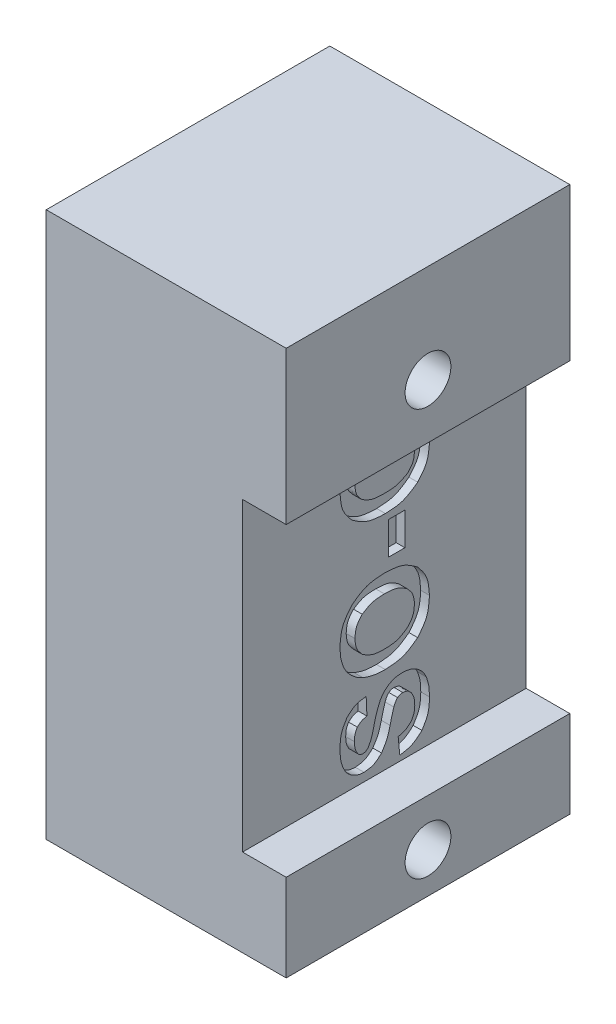
from build123d import *

# Parameters (mm, degrees)
ESQUISSE1_W                         = 25
ESQUISSE1_H                         = 13
BOSS_EXTRU_1_DEPTH                  = 11
ESQUISSE2_W                         = 2
ESQUISSE2_H                         = 14
ENL_V_MAT_EXTRU_1_DEPTH             = 36.605336679
ENL_V_START                         = 1.2
ENL_V_MAT_EXTRU_2_DEPTH             = 0.4
BOSS_EXTRU_2_START                  = 1.2
BOSS_EXTRU_2_DEPTH                  = 0.4
ENL_V_MAT_EXTRU_3_DEPTH             = 0.4
ENL_V_MAT_EXTRU_4_DEPTH             = 0.4
ESQUISSE7_W                         = 0.760486722
ESQUISSE7_H                         = 1.493910551
ENL_V_MAT_EXTRU_5_DEPTH             = 0.4
DIAM_TRE_DU_PER_AGE_2_1_2_1_1_D     = 2.1
DIAM_TRE_DU_PER_AGE_2_1_2_1_1_DEPTH = 8
DIAM_TRE_DU_PER_AGE_2_1_2_1_2_D     = 2.1
DIAM_TRE_DU_PER_AGE_2_1_2_1_2_DEPTH = 8
DIAM_TRE_DU_PER_AGE_2_1_2_1_3_D     = 2.1
DIAM_TRE_DU_PER_AGE_2_1_2_1_3_DEPTH = 10


with BuildPart() as part:
    # Esquisse1 → Boss.-Extru.1 (new body)
    with BuildSketch(Plane(origin=(-30.7, 0, 0), x_dir=(0, -1, 0), z_dir=(-1, 0, 0))):
        Rectangle(ESQUISSE1_W, ESQUISSE1_H)
    extrude(amount=-BOSS_EXTRU_1_DEPTH)

    # Esquisse2 → Enlèv. mat.-Extru.1 (cut, through all)
    with BuildSketch(Plane.XY.offset(6.5)):
        with Locations((-20.7, -1.5)):
            Rectangle(ESQUISSE2_W, ESQUISSE2_H)
    extrude(amount=-ENL_V_MAT_EXTRU_1_DEPTH, mode=Mode.SUBTRACT)

    # Esquisse3 → Enlèv. mat.-Extru.2 (cut)
    with BuildSketch(Plane(origin=(-22.9, 0, 0), x_dir=(0, 0, -1), z_dir=(1, 0, 0)).offset(ENL_V_START)):
        with BuildLine():
            add(Edge.make_bspline(
                [(0.040594995, -4.523004446), (-0.046422495, -4.520684567), (-0.219772179, -4.516063079), (-0.478972443, -4.491355823), (-0.731337882, -4.427247103), (-0.894894011, -4.370276318), (-0.976995766, -4.341678176)],
                knots=[0, 0, 0, 0, 0.251162513, 0.500347025, 0.749184658, 1, 1, 1, 1], degree=3))
            add(Edge.make_bspline(
                [(-0.976995766, -4.341678176), (-1.026357361, -4.316975059), (-1.124792503, -4.267712979), (-1.267429981, -4.184138388), (-1.397682287, -4.082332373), (-1.479796659, -4.009022434), (-1.52097398, -3.972260211)],
                knots=[0, 0, 0, 0, 0.250726491, 0.499989878, 0.749263416, 1, 1, 1, 1], degree=3))
            add(Edge.make_bspline(
                [(-1.52097398, -3.972260211), (-1.557178279, -3.934098826), (-1.629307823, -3.858070192), (-1.729119676, -3.736334691), (-1.809138662, -3.600764554), (-1.855129407, -3.50664624), (-1.878213823, -3.45940486)],
                knots=[0, 0, 0, 0, 0.251028015, 0.500121179, 0.749092765, 1, 1, 1, 1], degree=3))
            add(Edge.make_bspline(
                [(-1.878213823, -3.45940486), (-1.902220115, -3.390341102), (-1.950052601, -3.25273171), (-2.005132825, -3.040816696), (-2.027729246, -2.823032417), (-2.032691965, -2.67732347), (-2.035182655, -2.604195032)],
                knots=[0, 0, 0, 0, 0.250838507, 0.499795194, 0.748957105, 1, 1, 1, 1], degree=3))
            add(Edge.make_bspline(
                [(-2.035182655, -2.604195032), (-2.026340136, -2.473815013), (-2.008930644, -2.217117807), (-1.929735902, -1.837119439), (-1.735359102, -1.501123085), (-1.573448479, -1.30206219), (-1.491204441, -1.200947318)],
                knots=[0, 0, 0, 0, 0.254339308, 0.500753032, 0.746402764, 1, 1, 1, 1], degree=3))
            add(Edge.make_bspline(
                [(-1.491204441, -1.200947318), (-1.380071608, -1.118987874), (-1.160946279, -0.957384955), (-0.795128636, -0.768288084), (-0.389803116, -0.695631023), (-0.116794444, -0.681650484), (0.021650851, -0.674560819)],
                knots=[0, 0, 0, 0, 0.253014305, 0.498879059, 0.745876803, 1, 1, 1, 1], degree=3))
            add(Edge.make_bspline(
                [(0.021650851, -0.674560819), (0.159167503, -0.681650554), (0.430369175, -0.695632483), (0.833008724, -0.767873806), (1.196561887, -0.95543316), (1.414508778, -1.115642867), (1.525033772, -1.196888242)],
                knots=[0, 0, 0, 0, 0.254088734, 0.501097783, 0.746997243, 1, 1, 1, 1], degree=3))
            add(Edge.make_bspline(
                [(1.525033772, -1.196888242), (1.607118875, -1.297413695), (1.768699501, -1.495293274), (1.962661916, -1.829598882), (2.04157244, -2.207949878), (2.058871581, -2.463538996), (2.067658961, -2.593369637)],
                knots=[0, 0, 0, 0, 0.253616174, 0.499231391, 0.745626458, 1, 1, 1, 1], degree=3))
            add(Edge.make_bspline(
                [(2.067658961, -2.593369637), (2.059143735, -2.723983704), (2.042378031, -2.981150912), (1.964487284, -3.362002257), (1.771283211, -3.699334424), (1.609776883, -3.899170914), (1.527740419, -4.000677023)],
                knots=[0, 0, 0, 0, 0.254372897, 0.500837075, 0.74645228, 1, 1, 1, 1], degree=3))
            add(Edge.make_bspline(
                [(1.527740419, -4.000677023), (1.418586795, -4.081646603), (1.203372143, -4.241291691), (0.844072853, -4.428732714), (0.445406966, -4.501428012), (0.176809234, -4.515744242), (0.040594995, -4.523004446)],
                knots=[0, 0, 0, 0, 0.25305653, 0.498943336, 0.74589863, 1, 1, 1, 1], degree=3))
        make_face()
    extrude(amount=-ENL_V_MAT_EXTRU_2_DEPTH, mode=Mode.SUBTRACT)

    # Esquisse4 → Boss.-Extru.2 (add)
    with BuildSketch(Plane(origin=(-20.9, 0, 0), x_dir=(0, -1, 0), z_dir=(-1, 0, 0)).offset(BOSS_EXTRU_2_START)):
        with BuildLine():
            add(Edge.make_bspline(
                [(3.394452486, 1.010825574), (3.443912481, 0.933792398), (3.541639282, 0.781584417), (3.651183184, 0.531021304), (3.689489976, 0.260274993), (3.694851512, 0.078471065), (3.697564755, -0.013532102)],
                knots=[0, 0, 0, 0, 0.252270406, 0.49845496, 0.746189574, 1, 1, 1, 1], degree=3))
            add(Edge.make_bspline(
                [(3.697564755, -0.013532102), (3.694414508, -0.105526456), (3.688190776, -0.287273553), (3.647935026, -0.557798315), (3.535654055, -0.8072106), (3.436517625, -0.958564642), (3.386333141, -1.035182536)],
                knots=[0, 0, 0, 0, 0.253802578, 0.501420795, 0.747611043, 1, 1, 1, 1], degree=3))
            add(Edge.make_bspline(
                [(3.386333141, -1.035182536), (3.330815111, -1.085902627), (3.221714119, -1.185574971), (3.035164564, -1.308720354), (2.818246912, -1.362683644), (2.67100264, -1.376115239), (2.596076284, -1.382950008)],
                knots=[0, 0, 0, 0, 0.254357119, 0.499848676, 0.745494232, 1, 1, 1, 1], degree=3))
            add(Edge.make_bspline(
                [(2.596076284, -1.382950008), (2.521526964, -1.376269982), (2.375039389, -1.363143896), (2.15917707, -1.309881978), (1.973527771, -1.187538184), (1.865073728, -1.088362432), (1.809878502, -1.037889183)],
                knots=[0, 0, 0, 0, 0.25456394, 0.500211864, 0.745644162, 1, 1, 1, 1], degree=3))
            add(Edge.make_bspline(
                [(1.809878502, -1.037889183), (1.759857117, -0.960041305), (1.661019721, -0.806221464), (1.55005107, -0.553066862), (1.511074144, -0.279440547), (1.505518165, -0.095692068), (1.502706561, -0.00270611)],
                knots=[0, 0, 0, 0, 0.252280735, 0.498482217, 0.746206815, 1, 1, 1, 1], degree=3))
            add(Edge.make_bspline(
                [(1.502706561, -0.00270611), (1.505309223, 0.08863176), (1.510452564, 0.269132281), (1.54805992, 0.537966508), (1.656170468, 0.78698293), (1.752838656, 0.938305219), (1.801759753, 1.014885247)],
                knots=[0, 0, 0, 0, 0.253806378, 0.50156833, 0.747757507, 1, 1, 1, 1], degree=3))
            add(Edge.make_bspline(
                [(1.801759753, 1.014885247), (1.857757724, 1.064861164), (1.967795985, 1.163065849), (2.156234072, 1.282789354), (2.373779463, 1.332946883), (2.521107505, 1.344562847), (2.596076284, 1.350473702)],
                knots=[0, 0, 0, 0, 0.254161073, 0.499436709, 0.745285299, 1, 1, 1, 1], degree=3))
            add(Edge.make_bspline(
                [(2.596076284, 1.350473702), (2.671482303, 1.344366756), (2.819670952, 1.332365326), (3.038404084, 1.281254226), (3.227646687, 1.160239733), (3.338195676, 1.061216891), (3.394452486, 1.010825574)],
                knots=[0, 0, 0, 0, 0.254674744, 0.500489308, 0.745806107, 1, 1, 1, 1], degree=3))
        make_face()
    extrude(amount=-BOSS_EXTRU_2_DEPTH)

    # Esquisse5 → Enlèv. mat.-Extru.3 (cut)
    with BuildSketch(Plane(origin=(-22.9, 0, 0), x_dir=(0, 0, -1), z_dir=(1, 0, 0)).offset(ENL_V_START)):
        with BuildLine():
            Line((0.709066451, -8.263193894), (0.633288085, -7.483762208))
            add(Edge.make_bspline(
                [(0.633288085, -7.483762208), (0.687256765, -7.472084507), (0.794028455, -7.448981332), (0.949885206, -7.39706427), (1.087277118, -7.306991475), (1.168623101, -7.234755917), (1.209743083, -7.198241208)],
                knots=[0, 0, 0, 0, 0.253315392, 0.501159424, 0.747838616, 1, 1, 1, 1], degree=3))
            add(Edge.make_bspline(
                [(1.209743083, -7.198241208), (1.238457302, -7.154637761), (1.295204574, -7.068465241), (1.361071924, -6.92722817), (1.386435876, -6.773471154), (1.39130952, -6.670052932), (1.393775403, -6.617727134)],
                knots=[0, 0, 0, 0, 0.252518221, 0.499046139, 0.746535866, 1, 1, 1, 1], degree=3))
            add(Edge.make_bspline(
                [(1.393775403, -6.617727134), (1.39232195, -6.565717407), (1.389446587, -6.462826655), (1.36877357, -6.309509672), (1.309717622, -6.166508798), (1.256794187, -6.078829955), (1.230040252, -6.034506414)],
                knots=[0, 0, 0, 0, 0.253454508, 0.501408609, 0.747951331, 1, 1, 1, 1], degree=3))
            add(Edge.make_bspline(
                [(1.230040252, -6.034506414), (1.20390277, -6.007361843), (1.152605236, -5.954087791), (1.064043427, -5.885996615), (0.957416608, -5.852670934), (0.884333544, -5.843148162), (0.847090542, -5.838295374)],
                knots=[0, 0, 0, 0, 0.255257105, 0.500968698, 0.745694518, 1, 1, 1, 1], degree=3))
            add(Edge.make_bspline(
                [(0.847090542, -5.838295374), (0.825381456, -5.839787761), (0.782471301, -5.842737611), (0.718851335, -5.855139298), (0.660953948, -5.884281969), (0.62550997, -5.908557581), (0.607577622, -5.920839462)],
                knots=[0, 0, 0, 0, 0.253127404, 0.50033132, 0.747200143, 1, 1, 1, 1], degree=3))
            add(Edge.make_bspline(
                [(0.607577622, -5.920839462), (0.588460605, -5.941773322), (0.550457616, -5.983388037), (0.501028126, -6.052392781), (0.465324019, -6.129394251), (0.445630421, -6.182401707), (0.435723722, -6.209066663)],
                knots=[0, 0, 0, 0, 0.251043979, 0.499053863, 0.748003242, 1, 1, 1, 1], degree=3))
            ThreePointArc((0.435723722, -6.209066663), (0.343828327, -6.528341304), (0.262516797, -6.850474034))
            add(Edge.make_bspline(
                [(0.262516797, -6.850474034), (0.241976515, -6.93115612), (0.201092051, -7.091750022), (0.123485013, -7.3279421), (0.008442026, -7.548357323), (-0.083643242, -7.685500076), (-0.129905283, -7.754398216)],
                knots=[0, 0, 0, 0, 0.25164559, 0.50088872, 0.749255151, 1, 1, 1, 1], degree=3))
            add(Edge.make_bspline(
                [(-0.129905283, -7.754398216), (-0.185795656, -7.806654055), (-0.295635847, -7.909351373), (-0.483202072, -8.037727861), (-0.702793417, -8.096393119), (-0.85223705, -8.11187755), (-0.928281486, -8.119756807)],
                knots=[0, 0, 0, 0, 0.254537648, 0.500237559, 0.745695736, 1, 1, 1, 1], degree=3))
            add(Edge.make_bspline(
                [(-0.928281486, -8.119756807), (-0.978512466, -8.116034508), (-1.078171026, -8.108649445), (-1.226105087, -8.081251242), (-1.364255079, -8.021673352), (-1.451360542, -7.972624809), (-1.495264113, -7.947902981)],
                knots=[0, 0, 0, 0, 0.251968132, 0.499906252, 0.747938868, 1, 1, 1, 1], degree=3))
            add(Edge.make_bspline(
                [(-1.495264113, -7.947902981), (-1.538042945, -7.914536074), (-1.622887543, -7.84835844), (-1.738409967, -7.734679897), (-1.825181626, -7.597792301), (-1.873032093, -7.501293315), (-1.897157967, -7.452639196)],
                knots=[0, 0, 0, 0, 0.251958418, 0.499717032, 0.7477608, 1, 1, 1, 1], degree=3))
            add(Edge.make_bspline(
                [(-1.897157967, -7.452639196), (-1.918714534, -7.389554812), (-1.961665947, -7.263859314), (-2.010344633, -7.07021971), (-2.029490521, -6.871478992), (-2.033280526, -6.738562347), (-2.035182655, -6.671854112)],
                knots=[0, 0, 0, 0, 0.250795609, 0.499709706, 0.748914199, 1, 1, 1, 1], degree=3))
            add(Edge.make_bspline(
                [(-2.035182655, -6.671854112), (-2.032174727, -6.571119326), (-2.026228196, -6.371971403), (-1.984640816, -6.075351621), (-1.866442291, -5.800116506), (-1.761035373, -5.632270265), (-1.707712948, -5.547361527)],
                knots=[0, 0, 0, 0, 0.25365234, 0.501458717, 0.747801849, 1, 1, 1, 1], degree=3))
            add(Edge.make_bspline(
                [(-1.707712948, -5.547361527), (-1.646474429, -5.490800728), (-1.526027277, -5.379553966), (-1.319583893, -5.242044736), (-1.079737579, -5.178797033), (-0.916531782, -5.160289094), (-0.833558977, -5.150879774)],
                knots=[0, 0, 0, 0, 0.253962076, 0.499506011, 0.745551991, 1, 1, 1, 1], degree=3))
            Line((-0.833558977, -5.150879774), (-0.798376143, -5.951962624))
            add(Edge.make_bspline(
                [(-0.798376143, -5.951962624), (-0.839940246, -5.960452836), (-0.922041667, -5.977223521), (-1.041844562, -6.016375643), (-1.146349606, -6.086847422), (-1.207300022, -6.143730605), (-1.238159478, -6.172530804)],
                knots=[0, 0, 0, 0, 0.253847823, 0.501424673, 0.747569185, 1, 1, 1, 1], degree=3))
            add(Edge.make_bspline(
                [(-1.238159478, -6.172530804), (-1.260257835, -6.211442959), (-1.304013687, -6.288490969), (-1.352316785, -6.413255909), (-1.368939308, -6.545998065), (-1.371055695, -6.635017617), (-1.372124493, -6.679973457)],
                knots=[0, 0, 0, 0, 0.25182155, 0.498619246, 0.746797278, 1, 1, 1, 1], degree=3))
            add(Edge.make_bspline(
                [(-1.372124493, -6.679973457), (-1.37058718, -6.728220695), (-1.367540153, -6.823848977), (-1.348753083, -6.966416031), (-1.297369106, -7.100729733), (-1.251719631, -7.184427942), (-1.228687108, -7.22665802)],
                knots=[0, 0, 0, 0, 0.252763647, 0.50098937, 0.748223311, 1, 1, 1, 1], degree=3))
            add(Edge.make_bspline(
                [(-1.228687108, -7.22665802), (-1.212421936, -7.24493005), (-1.180615671, -7.280660692), (-1.123878328, -7.325809398), (-1.054250125, -7.346043928), (-1.006717173, -7.351213382), (-0.98240906, -7.353857014)],
                knots=[0, 0, 0, 0, 0.255760638, 0.500135554, 0.744371831, 1, 1, 1, 1], degree=3))
            add(Edge.make_bspline(
                [(-0.98240906, -7.353857014), (-0.959110427, -7.351090783), (-0.913387043, -7.345662075), (-0.84647801, -7.325949393), (-0.790497868, -7.284337266), (-0.758066952, -7.251505262), (-0.741543114, -7.234777067)],
                knots=[0, 0, 0, 0, 0.254456033, 0.499367959, 0.744923565, 1, 1, 1, 1], degree=3))
            add(Edge.make_bspline(
                [(-0.741543114, -7.234777067), (-0.710086441, -7.177188167), (-0.647363389, -7.062358745), (-0.57177442, -6.880668102), (-0.519166251, -6.691060704), (-0.490631725, -6.562920729), (-0.476319134, -6.498647187)],
                knots=[0, 0, 0, 0, 0.250287699, 0.499061312, 0.748734897, 1, 1, 1, 1], degree=3))
            ThreePointArc((-0.476319134, -6.498647187), (-0.358855564, -6.057953043), (-0.190798581, -5.633964989))
            add(Edge.make_bspline(
                [(-0.190798581, -5.633964989), (-0.164703473, -5.590728045), (-0.112865755, -5.50483821), (-0.022753044, -5.38380573), (0.09013207, -5.283674019), (0.171492446, -5.225047458), (0.212449491, -5.19553468)],
                knots=[0, 0, 0, 0, 0.251752895, 0.500105059, 0.748351464, 1, 1, 1, 1], degree=3))
            add(Edge.make_bspline(
                [(0.212449491, -5.19553468), (0.26197014, -5.171062156), (0.360296503, -5.122470421), (0.515666779, -5.066415485), (0.679322958, -5.044115112), (0.789098772, -5.039524676), (0.844384491, -5.037212823)],
                knots=[0, 0, 0, 0, 0.251570815, 0.49950967, 0.747941124, 1, 1, 1, 1], degree=3))
            add(Edge.make_bspline(
                [(0.844384491, -5.037212823), (0.900834307, -5.041297249), (1.012864451, -5.049403189), (1.179233751, -5.079547605), (1.335035336, -5.145221586), (1.433480734, -5.199372421), (1.483085215, -5.226657841)],
                knots=[0, 0, 0, 0, 0.251899613, 0.499919254, 0.748020263, 1, 1, 1, 1], degree=3))
            add(Edge.make_bspline(
                [(1.483085215, -5.226657841), (1.530307333, -5.262374783), (1.623911725, -5.333173442), (1.751611407, -5.455434996), (1.84707773, -5.60423283), (1.89925354, -5.709441585), (1.925575197, -5.762517307)],
                knots=[0, 0, 0, 0, 0.252156898, 0.49982919, 0.747673786, 1, 1, 1, 1], degree=3))
            add(Edge.make_bspline(
                [(1.925575197, -5.762517307), (1.948537187, -5.832403504), (1.99429761, -5.971678106), (2.045510093, -6.1860006), (2.065050032, -6.405483885), (2.068589139, -6.552217409), (2.070365012, -6.625846181)],
                knots=[0, 0, 0, 0, 0.250726032, 0.499666168, 0.748939679, 1, 1, 1, 1], degree=3))
            add(Edge.make_bspline(
                [(2.070365012, -6.625846181), (2.066607158, -6.729613423), (2.05917894, -6.934732021), (2.013582011, -7.240056263), (1.888415518, -7.522272706), (1.77830609, -7.694384701), (1.722598135, -7.781461779)],
                knots=[0, 0, 0, 0, 0.25358793, 0.501271881, 0.74767716, 1, 1, 1, 1], degree=3))
            add(Edge.make_bspline(
                [(1.722598135, -7.781461779), (1.650863627, -7.846042867), (1.509281285, -7.973506511), (1.268645982, -8.131608754), (0.992958268, -8.214628756), (0.804528329, -8.24686331), (0.709066451, -8.263193894)],
                knots=[0, 0, 0, 0, 0.252841872, 0.499033807, 0.746201828, 1, 1, 1, 1], degree=3))
        make_face()
    extrude(amount=-ENL_V_MAT_EXTRU_3_DEPTH, mode=Mode.SUBTRACT)

    # Esquisse6 → Enlèv. mat.-Extru.4 (cut)
    with BuildSketch(Plane(origin=(-22.9, 0, 0), x_dir=(0, 0, -1), z_dir=(1, 0, 0)).offset(ENL_V_START)):
        with BuildLine():
            Line((0.541271627, 4.340324249), (0.787550867, 5.117049064))
            add(Edge.make_bspline(
                [(0.787550867, 5.117049064), (0.879839209, 5.087230443), (1.0625705, 5.028189453), (1.326291166, 4.910275935), (1.552643675, 4.730768654), (1.685344334, 4.592725336), (1.752368271, 4.523002949)],
                knots=[0, 0, 0, 0, 0.25292829, 0.500799037, 0.747865502, 1, 1, 1, 1], degree=3))
            add(Edge.make_bspline(
                [(1.752368271, 4.523002949), (1.800824268, 4.442528702), (1.896764757, 4.283193654), (2.008801153, 4.02600793), (2.053563685, 3.749080955), (2.062929066, 3.562903077), (2.067658961, 3.468875732)],
                knots=[0, 0, 0, 0, 0.252212145, 0.499367632, 0.747160441, 1, 1, 1, 1], degree=3))
            add(Edge.make_bspline(
                [(2.067658961, 3.468875732), (2.057599742, 3.34701706), (2.037808704, 3.107265886), (1.955641439, 2.753325328), (1.764047457, 2.444587832), (1.607375698, 2.262418851), (1.527740419, 2.169823494)],
                knots=[0, 0, 0, 0, 0.254308376, 0.500339704, 0.746025786, 1, 1, 1, 1], degree=3))
            add(Edge.make_bspline(
                [(1.527740419, 2.169823494), (1.418837283, 2.090931249), (1.204007088, 1.935302706), (0.846827959, 1.752875175), (0.452073486, 1.682060997), (0.186190746, 1.668103459), (0.051420987, 1.661028709)],
                knots=[0, 0, 0, 0, 0.252946512, 0.498980568, 0.746044936, 1, 1, 1, 1], degree=3))
            add(Edge.make_bspline(
                [(0.051420987, 1.661028709), (-0.088487763, 1.667476783), (-0.364598557, 1.680202096), (-0.774904456, 1.749639241), (-1.148227619, 1.933533868), (-1.373157818, 2.092148873), (-1.487144768, 2.172529545)],
                knots=[0, 0, 0, 0, 0.253957413, 0.501186545, 0.747218362, 1, 1, 1, 1], degree=3))
            add(Edge.make_bspline(
                [(-1.487144768, 2.172529545), (-1.568998305, 2.268440237), (-1.73000739, 2.457100296), (-1.925366173, 2.777493513), (-2.006897615, 3.143780771), (-2.025650037, 3.391610087), (-2.035182655, 3.517591801)],
                knots=[0, 0, 0, 0, 0.253896252, 0.49942379, 0.745536767, 1, 1, 1, 1], degree=3))
            add(Edge.make_bspline(
                [(-2.035182655, 3.517591801), (-2.028196441, 3.626141361), (-2.014417545, 3.840233465), (-1.951838326, 4.157549325), (-1.798497796, 4.442323677), (-1.670017956, 4.613482116), (-1.604871094, 4.700269546)],
                knots=[0, 0, 0, 0, 0.253854576, 0.500676923, 0.746813731, 1, 1, 1, 1], degree=3))
            add(Edge.make_bspline(
                [(-1.604871094, 4.700269546), (-1.551416996, 4.746663475), (-1.445229024, 4.838826233), (-1.270795118, 4.958841352), (-1.075790959, 5.041310919), (-0.941668519, 5.084489573), (-0.874153912, 5.106224861)],
                knots=[0, 0, 0, 0, 0.251401467, 0.499415622, 0.748015637, 1, 1, 1, 1], degree=3))
            Line((-0.874153912, 5.106224861), (-0.684708893, 4.313261356))
            add(Edge.make_bspline(
                [(-0.684708893, 4.313261356), (-0.731438218, 4.299359166), (-0.823881707, 4.271856801), (-0.957224971, 4.214182381), (-1.070981185, 4.123811678), (-1.137983855, 4.054604753), (-1.171854079, 4.019620266)],
                knots=[0, 0, 0, 0, 0.252920981, 0.500347438, 0.747422842, 1, 1, 1, 1], degree=3))
            add(Edge.make_bspline(
                [(-1.171854079, 4.019620266), (-1.198597135, 3.978665139), (-1.251495878, 3.8976544), (-1.314600171, 3.766063513), (-1.341155847, 3.622562736), (-1.347344911, 3.525875229), (-1.350473702, 3.476996269)],
                knots=[0, 0, 0, 0, 0.252582767, 0.499617948, 0.747039148, 1, 1, 1, 1], degree=3))
            add(Edge.make_bspline(
                [(-1.350473702, 3.476996269), (-1.344484523, 3.408913479), (-1.332722472, 3.275206792), (-1.284222788, 3.078157466), (-1.171674497, 2.909297045), (-1.080339427, 2.811144551), (-1.033829987, 2.761163559)],
                knots=[0, 0, 0, 0, 0.25475494, 0.5003091, 0.74554852, 1, 1, 1, 1], degree=3))
            add(Edge.make_bspline(
                [(-1.033829987, 2.761163559), (-0.955843926, 2.714800072), (-0.8015923, 2.62309595), (-0.549271067, 2.523525568), (-0.279990901, 2.491063659), (-0.099410992, 2.48801065), (-0.008119285, 2.486467209)],
                knots=[0, 0, 0, 0, 0.251881115, 0.498205331, 0.746319, 1, 1, 1, 1], degree=3))
            add(Edge.make_bspline(
                [(-0.008119285, 2.486467209), (0.086774046, 2.48752806), (0.274602853, 2.489627874), (0.554860177, 2.520517172), (0.819213981, 2.618666546), (0.981572053, 2.710637255), (1.063599646, 2.75710329)],
                knots=[0, 0, 0, 0, 0.253546461, 0.50186171, 0.74832736, 1, 1, 1, 1], degree=3))
            add(Edge.make_bspline(
                [(1.063599646, 2.75710329), (1.110259953, 2.805885331), (1.201842486, 2.901632299), (1.315237051, 3.067060543), (1.364601525, 3.261451427), (1.37675708, 3.39348833), (1.382950008, 3.46075758)],
                knots=[0, 0, 0, 0, 0.25463653, 0.499787937, 0.745155412, 1, 1, 1, 1], degree=3))
            add(Edge.make_bspline(
                [(1.382950008, 3.46075758), (1.379010892, 3.511023963), (1.371232706, 3.610280063), (1.339987036, 3.757149262), (1.268544675, 3.889221515), (1.209749267, 3.969494488), (1.179972947, 4.010147896)],
                knots=[0, 0, 0, 0, 0.253298265, 0.500163256, 0.746862906, 1, 1, 1, 1], degree=3))
            add(Edge.make_bspline(
                [(1.179972947, 4.010147896), (1.133883885, 4.050344559), (1.042516006, 4.130031231), (0.889948183, 4.230827196), (0.718376127, 4.294042074), (0.600652796, 4.32480635), (0.541271627, 4.340324249)],
                knots=[0, 0, 0, 0, 0.251706413, 0.498987832, 0.74728299, 1, 1, 1, 1], degree=3))
        make_face()
    extrude(amount=-ENL_V_MAT_EXTRU_4_DEPTH, mode=Mode.SUBTRACT)

    # Esquisse7 → Enlèv. mat.-Extru.5 (cut)
    with BuildSketch(Plane(origin=(-21.7, 0, 0), x_dir=(0, 0, -1), z_dir=(1, 0, 0))):
        with Locations((0.561569691, 0.608253922)):
            Rectangle(ESQUISSE7_W, ESQUISSE7_H)
    extrude(amount=-ENL_V_MAT_EXTRU_5_DEPTH, mode=Mode.SUBTRACT)

    # Diamètre du perçage Ø2.1 (2.1)1
    with Locations(Plane.ZY.offset(30.7)):
        with Locations((0, 4.5)):
            Hole(DIAM_TRE_DU_PER_AGE_2_1_2_1_1_D / 2, depth=DIAM_TRE_DU_PER_AGE_2_1_2_1_1_DEPTH)

    # Diamètre du perçage Ø2.1 (2.1)2
    with Locations(Plane.ZY.offset(30.7)):
        with Locations((0, -7.000000104)):
            Hole(DIAM_TRE_DU_PER_AGE_2_1_2_1_2_D / 2, depth=DIAM_TRE_DU_PER_AGE_2_1_2_1_2_DEPTH)

    # Diamètre du perçage Ø2.1 (2.1)3
    with Locations(Plane(origin=(-19.7, 0, 0), x_dir=(0, 0, -1), z_dir=(1, 0, 0))):
        with Locations((0, 8), (0, -10.65)):
            Hole(DIAM_TRE_DU_PER_AGE_2_1_2_1_3_D / 2, depth=DIAM_TRE_DU_PER_AGE_2_1_2_1_3_DEPTH)


solid = part.part
